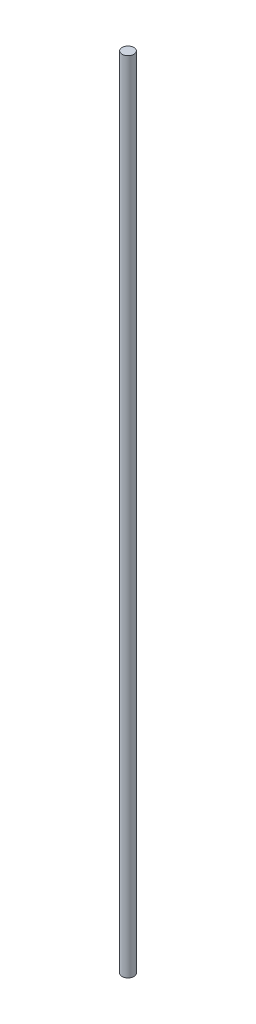
from build123d import *

# Parameters (mm, degrees)
SKETCH1_R           = 1
BOSS_EXTRUDE1_DEPTH = 135


with BuildPart() as part:
    # Sketch1 → Boss-Extrude1 (new body)
    with BuildSketch(Plane(origin=(0, 0, 0), x_dir=(1, 0, 0), z_dir=(0, 1, 0))):
        with Locations(Location((0, 0, 0), (0, 0, 270))):
            Circle(SKETCH1_R)
    extrude(amount=BOSS_EXTRUDE1_DEPTH)


solid = part.part
